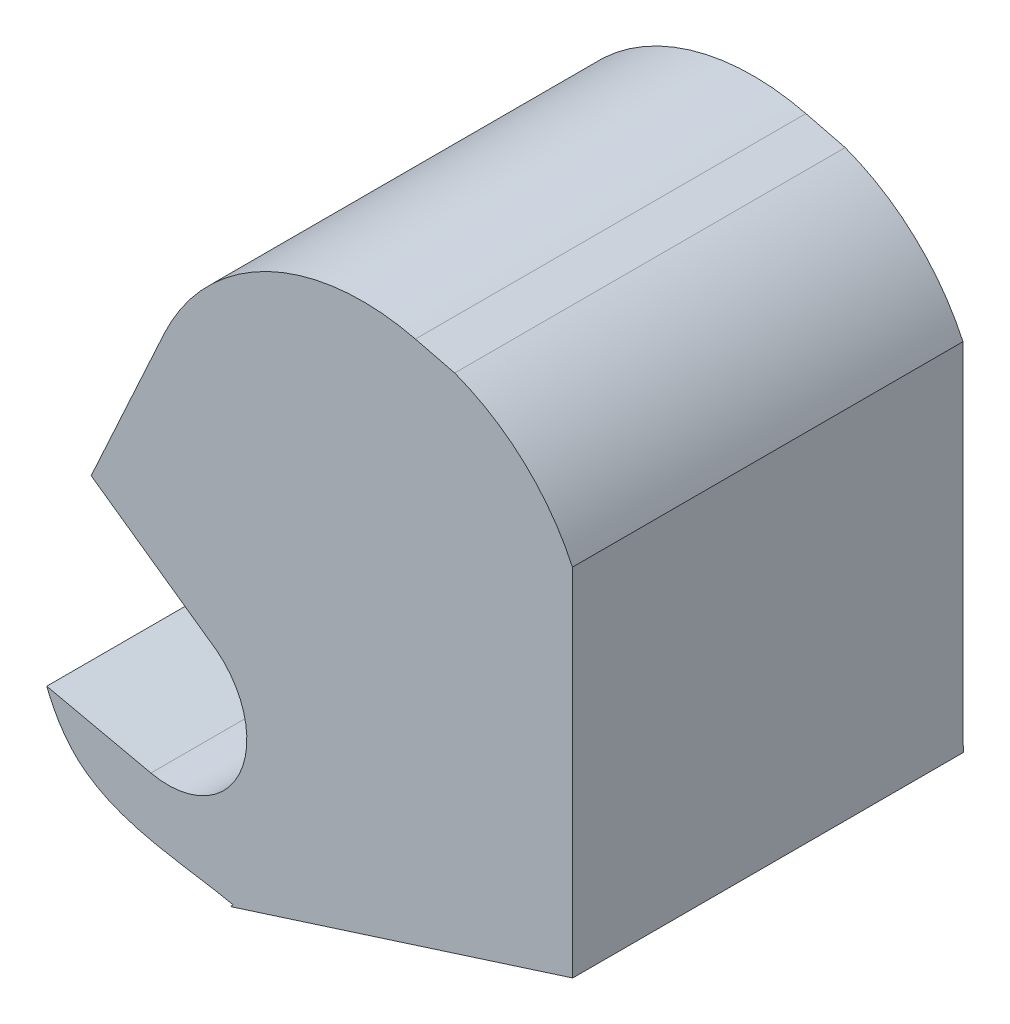
from build123d import *

# Parameters (mm, degrees)
BOSS_EXTRUDE1_DEPTH = 13


with BuildPart() as part:
    # Sketch1 → Boss-Extrude1 (new body)
    with BuildSketch(Plane.XY):
        with BuildLine():
            Line((169.562304459, -46.160309931), (169.552568547, -34.320764913))
            ThreePointArc((169.552568547, -34.320764913), (167.950993273, -32.115534783), (165.631816979, -30.683925688))
            Line((165.631816979, -30.683925688), (164.32472896, -30.359173472))
            ThreePointArc((164.32472896, -30.359173472), (159.414987624, -30.865423823), (155.959571946, -34.389902778))
            Line((155.959571946, -34.389902778), (153.531390597, -39.695181294))
            Line((153.531390597, -39.695181294), (157.716593531, -42.649808935))
            ThreePointArc((157.716593531, -42.649808935), (158.460324124, -45.836019732), (155.520515025, -47.27219413))
            Line((155.520515025, -47.27219413), (152.052832095, -46.502518371))
            add(Edge.make_bspline(
                [(158.254307893, -49.702990605), (156.613856565, -49.334233495), (153.519768391, -49.291899755), (152.26174626, -47.033082798), (152.052832095, -46.502518371)],
                knots=[0, 0, 0, 0, 0.763192253, 1, 1, 1, 1], degree=3))
            Line((158.254307893, -49.702990605), (158.172150747, -49.796885596))
            Line((158.172150747, -49.796885596), (169.562304459, -46.160309931))
        make_face()
    extrude(amount=BOSS_EXTRUDE1_DEPTH)


solid = part.part
